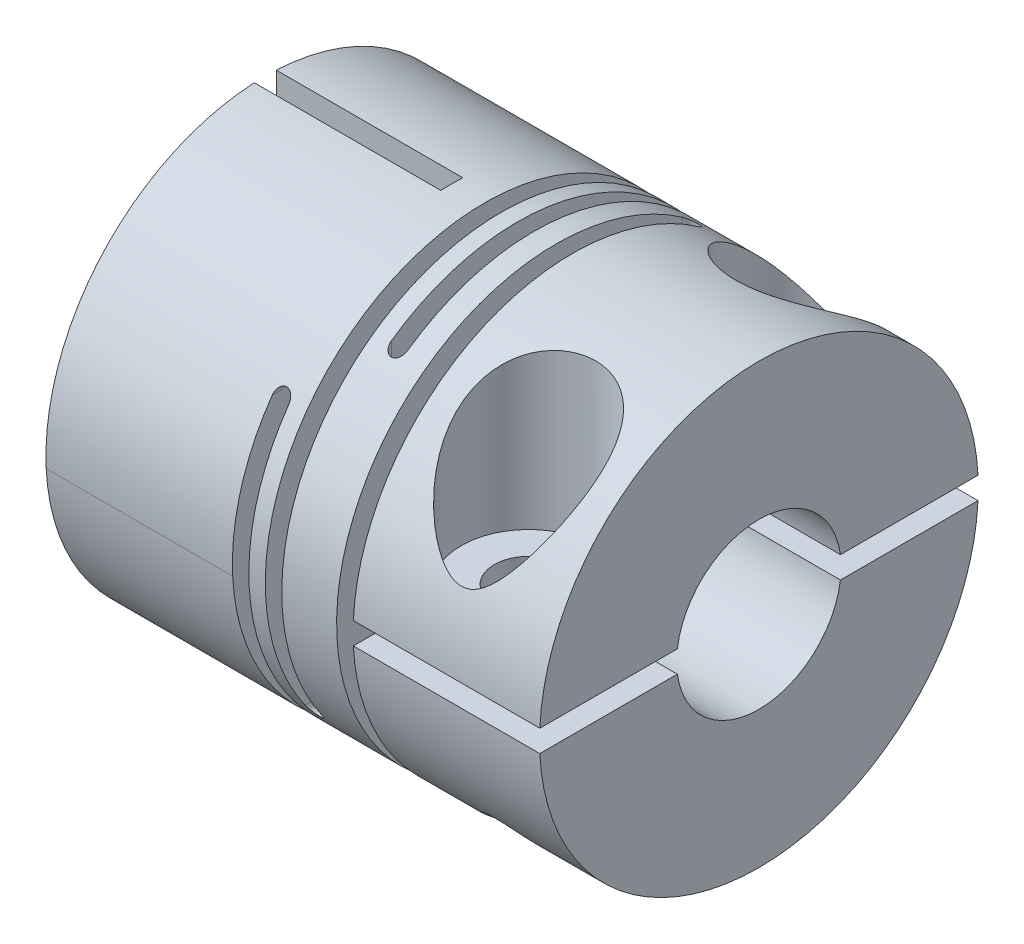
from build123d import *

# Parameters (mm, degrees)
SKETCH_6_R                     = 8
EXTRUDE_4_DEPTH                = 18
CUT_EXTRUDE_1_DEPTH            = 22.260291625
CUT_EXTRUDE_1_DEPTH_BACK       = 22.260291625
CUT_EXTRUDE_2_DEPTH            = 22.260291785
CUT_EXTRUDE_2_DEPTH_BACK       = 22.260291785
CUT_EXTRUDE_3_DEPTH            = 22.260291785
CUT_EXTRUDE_3_DEPTH_BACK       = 22.260291785
SKETCH_10_W                    = 6.8
SKETCH_10_H                    = 0.8
CUT_EXTRUDE_4_DEPTH            = 22.260291785
CUT_EXTRUDE_4_DEPTH_BACK       = 22.260291785
SKETCH_11_W                    = 6.8
SKETCH_11_H                    = 0.8
SKETCH_12_R                    = 2.5
CUT_EXTRUDE_6_DEPTH            = 6.8
SKETCH_14_R                    = 3
CUT_EXTRUDE_7_DEPTH            = 6.8
HOLE_WIZARD_M2_5_2_AT_2_COUNT  = 2
HOLE_WIZARD_M2_5_2_AT_2_PITCH  = 10
HOLE_WIZARD_M2_5_1_D           = 2.05
HOLE_WIZARD_M2_5_1_CSINK_D     = 2.55
HOLE_WIZARD_M2_5_1_CSINK_ANGLE = 90
CUT_EXTRUDE_START              = -3.75
SKETCH_27_R                    = 1.25
CUT_EXTRUDE_9_DEPTH            = 3.75


with BuildPart() as part:
    # 草图6 → 凸台-拉伸4 (new body)
    with BuildSketch(Plane(origin=(0, 0, 0), x_dir=(0, 0, -1), z_dir=(1, 0, 0))):
        Circle(SKETCH_6_R)
    extrude(amount=EXTRUDE_4_DEPTH)

    # 草图8 → 切除-拉伸1 (cut, two sides: drawn at the far end of the back side and taken through both)
    with BuildSketch(Plane.XY.offset(-CUT_EXTRUDE_1_DEPTH_BACK)):
        with BuildLine():
            Line((7.4, 4.6), (7.4, -8.719592595))
            ThreePointArc((7.4, -8.719592595), (7.1, -9.019592595), (6.8, -8.719592595))
            Line((6.8, -8.719592595), (6.8, 4.6))
            ThreePointArc((6.8, 4.6), (7.1, 4.9), (7.4, 4.6))
        make_face()
        with BuildLine():
            Line((8.6, 9.917704555), (8.6, -4.6))
            ThreePointArc((8.6, -4.6), (8.3, -4.9), (8, -4.6))
            Line((8, -4.6), (8, 9.917704555))
            ThreePointArc((8, 9.917704555), (8.3, 10.217704555), (8.6, 9.917704555))
        make_face()
    extrude(amount=CUT_EXTRUDE_1_DEPTH + CUT_EXTRUDE_1_DEPTH_BACK, mode=Mode.SUBTRACT)

    # 草图9 → 切除-拉伸2 (cut, two sides: drawn at the far end of the back side and taken through both)
    with BuildSketch(Plane(origin=(0, 0, 0), x_dir=(1, 0, 0), z_dir=(0, 1, 0)).offset(-CUT_EXTRUDE_2_DEPTH_BACK)):
        with BuildLine():
            Line((9.8, 9.784581004), (9.8, -4.6))
            ThreePointArc((9.8, -4.6), (9.5, -4.9), (9.2, -4.6))
            Line((9.2, -4.6), (9.2, 9.784581004))
            ThreePointArc((9.2, 9.784581004), (9.5, 10.084581004), (9.8, 9.784581004))
        make_face()
        with BuildLine():
            Line((11.2, 4.6), (11.2, -8.926673675))
            ThreePointArc((11.2, -8.926673675), (10.9, -9.226673675), (10.6, -8.926673675))
            Line((10.6, -8.926673675), (10.6, 4.6))
            ThreePointArc((10.6, 4.6), (10.9, 4.9), (11.2, 4.6))
        make_face()
    extrude(amount=CUT_EXTRUDE_2_DEPTH + CUT_EXTRUDE_2_DEPTH_BACK, mode=Mode.SUBTRACT)

    # 草图10 → 切除-拉伸3 (cut, two sides: drawn at the far end of the back side and taken through both)
    with BuildSketch(Plane.XY.offset(-CUT_EXTRUDE_3_DEPTH_BACK)):
        with Locations((14.6, 0)):
            Rectangle(SKETCH_10_W, SKETCH_10_H)
    extrude(amount=CUT_EXTRUDE_3_DEPTH + CUT_EXTRUDE_3_DEPTH_BACK, mode=Mode.SUBTRACT)

    # 草图11 → 切除-拉伸4 (cut, two sides: drawn at the far end of the back side and taken through both)
    with BuildSketch(Plane(origin=(0, 0, 0), x_dir=(1, 0, 0), z_dir=(0, 1, 0)).offset(-CUT_EXTRUDE_4_DEPTH_BACK)):
        with Locations((3.4, 0)):
            Rectangle(SKETCH_11_W, SKETCH_11_H)
    extrude(amount=CUT_EXTRUDE_4_DEPTH + CUT_EXTRUDE_4_DEPTH_BACK, mode=Mode.SUBTRACT)

    # 草图12 → 切除-拉伸6 (cut)
    with BuildSketch(Plane.ZY):
        Circle(SKETCH_12_R)
    extrude(amount=-CUT_EXTRUDE_6_DEPTH, mode=Mode.SUBTRACT)

    # 草图14 → 切除-拉伸7 (cut)
    with BuildSketch(Plane(origin=(18, 0, 0), x_dir=(0, 0, -1), z_dir=(1, 0, 0))):
        Circle(SKETCH_14_R)
    extrude(amount=-CUT_EXTRUDE_7_DEPTH, mode=Mode.SUBTRACT)

    # 草图24 → M2.5 六角圆柱头螺钉的柱形沉头孔2 (revolve, cut)
    with BuildSketch(Plane(origin=(14.6, 8, -5), x_dir=(0, 0, 1), z_dir=(1, 0, 0))):
        Polygon((0, 0), (0, 7.6), (1.25, 7.6), (1.25, 6.25), (2.45, 6.25), (2.45, 0.075), (2.525, 0), align=None)
    hole_wizard_m2_5_2 = revolve(axis=Axis((14.6, 14.35, -5), (0, -1, 0)), mode=Mode.SUBTRACT)

    # M2.5 六角圆柱头螺钉的柱形沉头孔2 at 2: M2.5 六角圆柱头螺钉的柱形沉头孔2 ×2
    with Locations(*[(0, 0, i * HOLE_WIZARD_M2_5_2_AT_2_PITCH) for i in range(1, HOLE_WIZARD_M2_5_2_AT_2_COUNT)]):
        add(hole_wizard_m2_5_2, mode=Mode.SUBTRACT)

    # M2.5 螺纹孔1 (through all)
    with Locations(Plane(origin=(0, -8, 0), x_dir=(-1, 0, 0), z_dir=(0, -1, 0))):
        with Locations((-14.6, 5), (-14.6, -5)):
            CounterSinkHole(HOLE_WIZARD_M2_5_1_D / 2, HOLE_WIZARD_M2_5_1_CSINK_D / 2, counter_sink_angle=HOLE_WIZARD_M2_5_1_CSINK_ANGLE)

    # 草图27 → 切除-拉伸9 (cut)
    with BuildSketch(Plane(origin=(0, -8, 0), x_dir=(-1, 0, 0), z_dir=(0, -1, 0)).offset(CUT_EXTRUDE_START)):
        with Locations(Location((-14.6, 5, 0), (0, 0, 270))):
            Circle(SKETCH_27_R)
        with Locations(Location((-14.6, -5, 0), (0, 0, 270))):
            Circle(SKETCH_27_R)
    extrude(amount=CUT_EXTRUDE_9_DEPTH, mode=Mode.SUBTRACT)


solid = part.part
